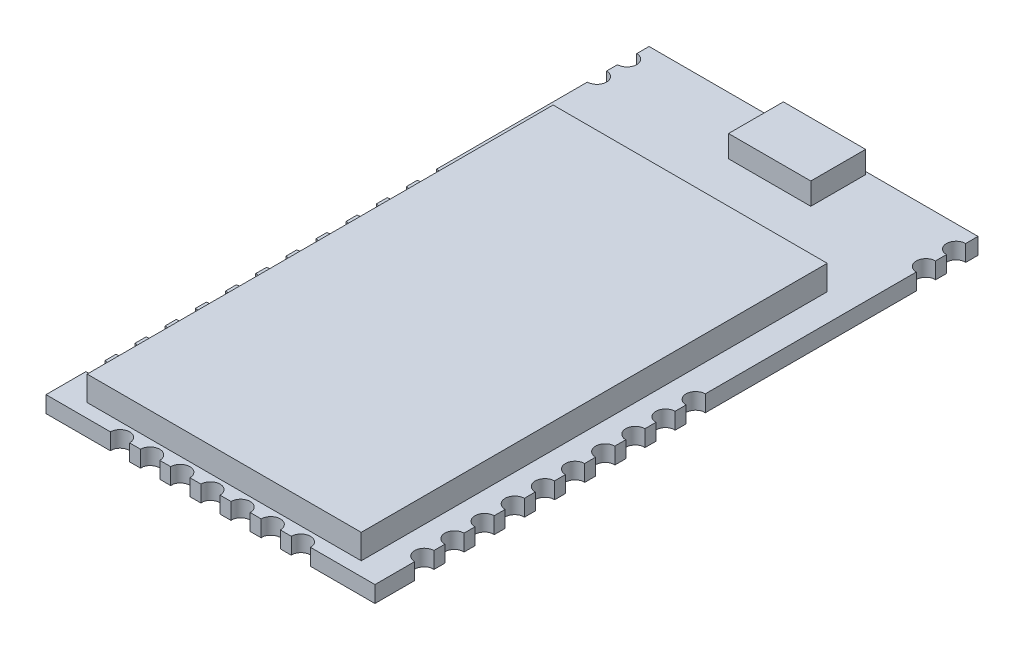
from build123d import *

# Parameters (mm, degrees)
SKETCH1_W           = 12
SKETCH1_H           = 22
BOSS_EXTRUDE1_DEPTH = 0.6
SKETCH2_R           = 0.35
PINS_LEFT_DEPTH     = 13.544321424
SKETCH3_R           = 0.35
CUT_EXTRUDE4_DEPTH  = 0.6
SKETCH4_R           = 0.35
CUT_EXTRUDE5_DEPTH  = 0.6
SKETCH9_R           = 0.35
CUT_EXTRUDE9_DEPTH  = 0.6
SKETCH5_W           = 10
SKETCH5_H           = 17
BOSS_EXTRUDE2_DEPTH = 0.9
SKETCH5_3_W         = 3
SKETCH5_3_H         = 2
BOSS_EXTRUDE3_DEPTH = 0.8
SKETCH7_W           = 0.7
SKETCH7_H           = 2
CUT_EXTRUDE7_DEPTH  = 0.01
SKETCH8_W           = 2
SKETCH8_H           = 0.7
CUT_EXTRUDE8_DEPTH  = 0.01
SKETCH10_W          = 2
SKETCH10_H          = 0.7
CUT_EXTRUDE10_DEPTH = 0.01
SKETCH11_W          = 2
SKETCH11_H          = 0.7
CUT_EXTRUDE11_DEPTH = 0.01


with BuildPart() as part:
    # Sketch1 → Boss-Extrude1 (new body)
    with BuildSketch(Plane(origin=(0, 0, 0), x_dir=(1, 0, 0), z_dir=(0, 1, 0))):
        Rectangle(SKETCH1_W, SKETCH1_H)
    extrude(amount=BOSS_EXTRUDE1_DEPTH)

    # Sketch2 → Pins left (cut, through all)
    with BuildSketch(Plane(origin=(0, 0, 0), x_dir=(1, 0, 0), z_dir=(0, 1, 0))):
        with Locations((-6, -9.2)):
            Circle(SKETCH2_R)
        with Locations((-6, -8.1)):
            Circle(SKETCH2_R)
        with Locations((-6, -7)):
            Circle(SKETCH2_R)
        with Locations((-6, -5.9)):
            Circle(SKETCH2_R)
        with Locations((-6, -4.8)):
            Circle(SKETCH2_R)
        with Locations((-6, -3.7)):
            Circle(SKETCH2_R)
        with Locations((-6, -2.6)):
            Circle(SKETCH2_R)
        with Locations((-6, -1.5)):
            Circle(SKETCH2_R)
        with Locations((-6, -0.4)):
            Circle(SKETCH2_R)
        with Locations((-6, 0.7)):
            Circle(SKETCH2_R)
        with Locations((-6, 1.8)):
            Circle(SKETCH2_R)
        with Locations((-6, 2.9)):
            Circle(SKETCH2_R)
    extrude(amount=PINS_LEFT_DEPTH, mode=Mode.SUBTRACT)

    # Sketch3 → Cut-Extrude4 (cut)
    with BuildSketch(Plane(origin=(0, 0.6, 0), x_dir=(1, 0, 0), z_dir=(0, 1, 0))):
        with Locations((-3.3, -11)):
            Circle(SKETCH3_R)
        with Locations((-2.2, -11)):
            Circle(SKETCH3_R)
        with Locations((-1.1, -11)):
            Circle(SKETCH3_R)
        with Locations((0, -11)):
            Circle(SKETCH3_R)
        with Locations((1.1, -11)):
            Circle(SKETCH3_R)
        with Locations((2.2, -11)):
            Circle(SKETCH3_R)
        with Locations((3.3, -11)):
            Circle(SKETCH3_R)
    extrude(amount=-CUT_EXTRUDE4_DEPTH, mode=Mode.SUBTRACT)

    # Sketch4 → Cut-Extrude5 (cut)
    with BuildSketch(Plane(origin=(0, 0.6, 0), x_dir=(1, 0, 0), z_dir=(0, 1, 0))):
        with Locations((6, -9.2)):
            Circle(SKETCH4_R)
        with Locations((6, -8.1)):
            Circle(SKETCH4_R)
        with Locations((6, -7)):
            Circle(SKETCH4_R)
        with Locations((6, -5.9)):
            Circle(SKETCH4_R)
        with Locations((6, -4.8)):
            Circle(SKETCH4_R)
        with Locations((6, -3.7)):
            Circle(SKETCH4_R)
        with Locations((6, -2.6)):
            Circle(SKETCH4_R)
        with Locations((6, -1.5)):
            Circle(SKETCH4_R)
        with Locations((6, -0.4)):
            Circle(SKETCH4_R)
        with Locations((6, 0.7)):
            Circle(SKETCH4_R)
    extrude(amount=-CUT_EXTRUDE5_DEPTH, mode=Mode.SUBTRACT)

    # Sketch9 → Cut-Extrude9 (cut)
    with BuildSketch(Plane.XZ):
        with Locations((-6, -9.1)):
            Circle(SKETCH9_R)
        with Locations((-6, -10.2)):
            Circle(SKETCH9_R)
        with Locations((6, -9.1)):
            Circle(SKETCH9_R)
        with Locations((6, -10.2)):
            Circle(SKETCH9_R)
    extrude(amount=-CUT_EXTRUDE9_DEPTH, mode=Mode.SUBTRACT)

    # Sketch5 → Boss-Extrude2 (add)
    with BuildSketch(Plane(origin=(0, 0.6, 0), x_dir=(1, 0, 0), z_dir=(0, 1, 0))):
        with Locations((0, -2)):
            Rectangle(SKETCH5_W, SKETCH5_H)
    extrude(amount=BOSS_EXTRUDE2_DEPTH)

    # Sketch5<3> → Boss-Extrude3 (add)
    with BuildSketch(Plane(origin=(0, 0.6, 0), x_dir=(1, 0, 0), z_dir=(0, 1, 0))):
        with Locations((0.5, 9.9)):
            Rectangle(SKETCH5_3_W, SKETCH5_3_H)
    extrude(amount=BOSS_EXTRUDE3_DEPTH)

    # Sketch7 → Cut-Extrude7 (cut)
    with BuildSketch(Plane.XZ):
        with Locations((2.2, 11)):
            Rectangle(SKETCH7_W, SKETCH7_H)
        with Locations((3.3, 11)):
            Rectangle(SKETCH7_W, SKETCH7_H)
        with Locations((1.1, 11)):
            Rectangle(SKETCH7_W, SKETCH7_H)
        with Locations((0, 11)):
            Rectangle(SKETCH7_W, SKETCH7_H)
        with Locations((-1.1, 11)):
            Rectangle(SKETCH7_W, SKETCH7_H)
        with Locations((-2.2, 11)):
            Rectangle(SKETCH7_W, SKETCH7_H)
        with Locations((-3.3, 11)):
            Rectangle(SKETCH7_W, SKETCH7_H)
    extrude(amount=-CUT_EXTRUDE7_DEPTH, mode=Mode.SUBTRACT)

    # Sketch8 → Cut-Extrude8 (cut)
    with BuildSketch(Plane.XZ):
        with Locations((-6, 8.1)):
            Rectangle(SKETCH8_W, SKETCH8_H)
        with Locations((-6, 9.2)):
            Rectangle(SKETCH8_W, SKETCH8_H)
        with Locations((-6, 7)):
            Rectangle(SKETCH8_W, SKETCH8_H)
        with Locations((-6, 5.9)):
            Rectangle(SKETCH8_W, SKETCH8_H)
        with Locations((-6, 4.8)):
            Rectangle(SKETCH8_W, SKETCH8_H)
        with Locations((-6, 3.7)):
            Rectangle(SKETCH8_W, SKETCH8_H)
        with Locations((-6, 2.6)):
            Rectangle(SKETCH8_W, SKETCH8_H)
        with Locations((-6, 1.5)):
            Rectangle(SKETCH8_W, SKETCH8_H)
        with Locations((-6, 0.4)):
            Rectangle(SKETCH8_W, SKETCH8_H)
        with Locations((-6, -0.7)):
            Rectangle(SKETCH8_W, SKETCH8_H)
        with Locations((-6, -1.8)):
            Rectangle(SKETCH8_W, SKETCH8_H)
        with Locations((-6, -2.9)):
            Rectangle(SKETCH8_W, SKETCH8_H)
    extrude(amount=-CUT_EXTRUDE8_DEPTH, mode=Mode.SUBTRACT)

    # Sketch10 → Cut-Extrude10 (cut)
    with BuildSketch(Plane.XZ):
        with Locations((5.65, 9.2)):
            Rectangle(SKETCH10_W, SKETCH10_H)
        with Locations((5.65, 8.1)):
            Rectangle(SKETCH10_W, SKETCH10_H)
        with Locations((5.65, 7)):
            Rectangle(SKETCH10_W, SKETCH10_H)
        with Locations((5.65, 5.9)):
            Rectangle(SKETCH10_W, SKETCH10_H)
        with Locations((5.65, 4.8)):
            Rectangle(SKETCH10_W, SKETCH10_H)
        with Locations((5.65, 3.7)):
            Rectangle(SKETCH10_W, SKETCH10_H)
        with Locations((5.65, 2.6)):
            Rectangle(SKETCH10_W, SKETCH10_H)
        with Locations((5.65, 1.5)):
            Rectangle(SKETCH10_W, SKETCH10_H)
        with Locations((5.65, 0.4)):
            Rectangle(SKETCH10_W, SKETCH10_H)
        with Locations((5.65, -0.7)):
            Rectangle(SKETCH10_W, SKETCH10_H)
    extrude(amount=-CUT_EXTRUDE10_DEPTH, mode=Mode.SUBTRACT)

    # Sketch11 → Cut-Extrude11 (cut)
    with BuildSketch(Plane.XZ):
        with Locations((5.65, -10.2)):
            Rectangle(SKETCH11_W, SKETCH11_H)
        with Locations((5.65, -9.1)):
            Rectangle(SKETCH11_W, SKETCH11_H)
        with Locations((-5.65, -10.2)):
            Rectangle(SKETCH11_W, SKETCH11_H)
        with Locations((-5.65, -9.1)):
            Rectangle(SKETCH11_W, SKETCH11_H)
    extrude(amount=-CUT_EXTRUDE11_DEPTH, mode=Mode.SUBTRACT)


solid = part.part
